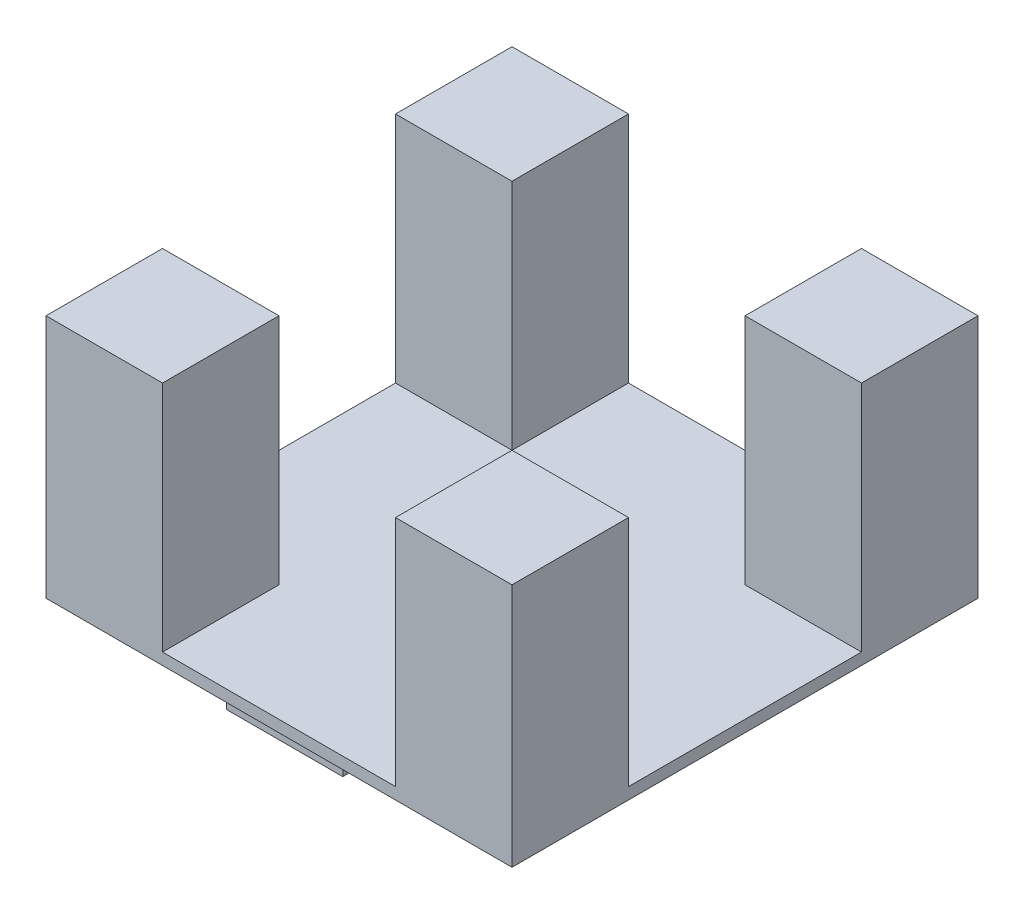
from build123d import *

# Parameters (mm, degrees)
SKETCH1_W                                  = 2000
SKETCH1_H                                  = 2000
BOSS_EXTRUDE1_DEPTH                        = 50
SKETCH2_W                                  = 500
SKETCH2_H                                  = 500
BOSS_EXTRUDE2_DEPTH                        = 1000
MIRROR2_AT_THE_SECOND_PLANE_COPY_1_SKETC_W = 500
MIRROR2_AT_THE_SECOND_PLANE_COPY_1_SKETC_H = 500
MIRROR2_AT_THE_SECOND_PLANE_COPY_1_DEPTH   = 1000
SKETCH4_W                                  = 500
SKETCH4_H                                  = 500
BOSS_EXTRUDE4_DEPTH                        = 50


with BuildPart() as part:
    # Sketch1 → Boss-Extrude1 (new body)
    with BuildSketch(Plane(origin=(0, 0, 0), x_dir=(1, 0, 0), z_dir=(0, 1, 0))):
        Rectangle(SKETCH1_W, SKETCH1_H)
    extrude(amount=BOSS_EXTRUDE1_DEPTH)

    # Sketch2 → Boss-Extrude2 (add)
    with BuildSketch(Plane(origin=(0, 50, 0), x_dir=(1, 0, 0), z_dir=(0, 1, 0))):
        with Locations((-750, 750)):
            Rectangle(SKETCH2_W, SKETCH2_H)
    boss_extrude2 = extrude(amount=BOSS_EXTRUDE2_DEPTH)

    # Mirror1: Boss-Extrude2 across plane
    add(boss_extrude2.mirror(Plane.XY))

    # Mirror2: Boss-Extrude2 across plane
    add(boss_extrude2.mirror(Plane.XY))

    # Mirror2 at the second plane: Boss-Extrude2 across plane
    add(boss_extrude2.mirror(Plane(origin=(0, 0, 0), x_dir=(0, 0, 1), z_dir=(1, 0, 0))))

    # Mirror2 at the second plane copy 1 sketc → Mirror2 at the second plane copy 1 (add)
    with BuildSketch(Plane(origin=(0, 50, 0), x_dir=(-1, 0, 0), z_dir=(0, 1, 0))):
        with Locations((-750, 750)):
            Rectangle(MIRROR2_AT_THE_SECOND_PLANE_COPY_1_SKETC_W, MIRROR2_AT_THE_SECOND_PLANE_COPY_1_SKETC_H)
    extrude(amount=MIRROR2_AT_THE_SECOND_PLANE_COPY_1_DEPTH)

    # Sketch4 → Boss-Extrude4 (add)
    with BuildSketch(Plane.XZ):
        with Locations((0, 726.243185446)):
            Rectangle(SKETCH4_W, SKETCH4_H)
    extrude(amount=BOSS_EXTRUDE4_DEPTH)


solid = part.part
